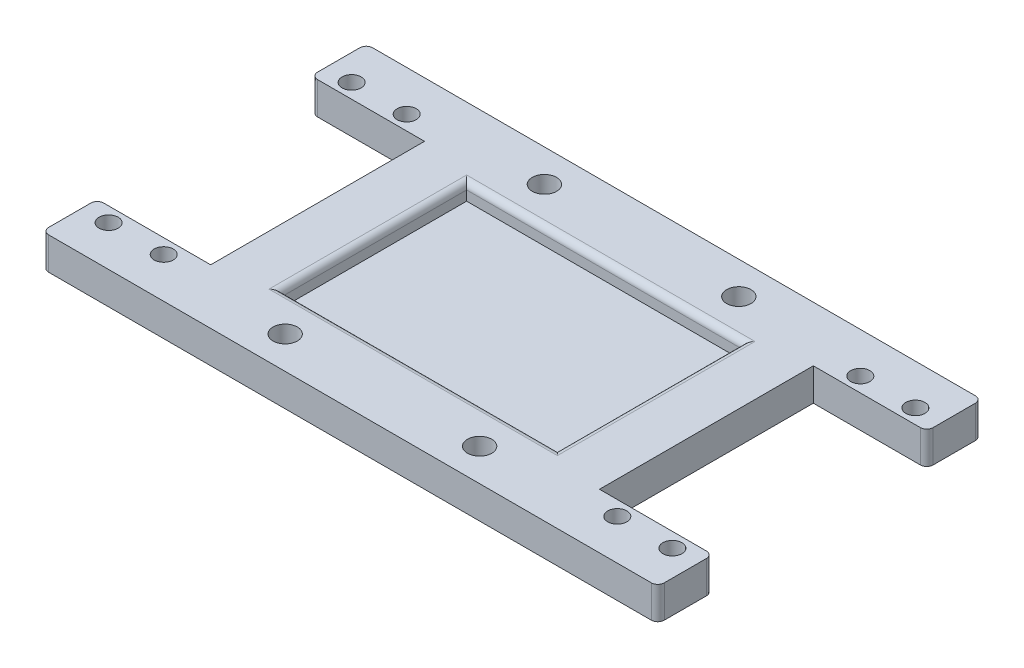
from build123d import *

# Parameters (mm, degrees)
SKETCH1_W               = 120
SKETCH1_H               = 100
BOSS_EXTRUDE1_DEPTH     = 5
SKETCH2_W               = 120
SKETCH2_H               = 100
SKETCH2_W_2             = 85
SKETCH2_H_2             = 57
BOSS_EXTRUDE2_DEPTH     = 5
SKETCH3_W               = 35
SKETCH3_H               = 17
BOSS_EXTRUDE3_DEPTH     = 10
CUT_EXTRUDE1_DEPTH      = 108.819293264
CUT_EXTRUDE1_DEPTH_BACK = 108.819293264
SKETCH4_R               = 2.95
FILLET1_R               = 2
CUT_EXTRUDE2_DEPTH      = 108.819293264
CUT_EXTRUDE2_DEPTH_BACK = 108.819293264
SKETCH5_R               = 3.75


with BuildPart() as part:
    # Sketch1 → Boss-Extrude1 (new body)
    with BuildSketch(Plane(origin=(0, 0, 0), x_dir=(1, 0, 0), z_dir=(0, 1, 0))):
        Rectangle(SKETCH1_W, SKETCH1_H)
    extrude(amount=BOSS_EXTRUDE1_DEPTH)

    # Sketch2 → Boss-Extrude2 (add)
    with BuildSketch(Plane(origin=(0, 5, 0), x_dir=(1, 0, 0), z_dir=(0, 1, 0))):
        Rectangle(SKETCH2_W, SKETCH2_H)
        Rectangle(SKETCH2_W_2, SKETCH2_H_2, mode=Mode.SUBTRACT)
    extrude(amount=BOSS_EXTRUDE2_DEPTH)

    # Sketch3 → Boss-Extrude3 (add)
    with BuildSketch(Plane.XZ):
        with Locations((77.5, 41.5)):
            Rectangle(SKETCH3_W, SKETCH3_H)
        with Locations((77.5, -41.5)):
            Rectangle(SKETCH3_W, SKETCH3_H)
        with Locations((-77.5, -41.5)):
            Rectangle(SKETCH3_W, SKETCH3_H)
        with Locations((-77.5, 41.5)):
            Rectangle(SKETCH3_W, SKETCH3_H)
    extrude(amount=-BOSS_EXTRUDE3_DEPTH)

    # Sketch4 → Cut-Extrude1 (cut, two sides: drawn at the far end of the back side and taken through both)
    with BuildSketch(Plane.XZ.offset(-CUT_EXTRUDE1_DEPTH_BACK)):
        with Locations(Location((70, 37.5, 0), (0, 0, 270))):
            Circle(SKETCH4_R)
        with Locations(Location((87, 37.5, 0), (0, 0, 270))):
            Circle(SKETCH4_R)
        with Locations(Location((70, -37.5, 0), (0, 0, 270))):
            Circle(SKETCH4_R)
        with Locations(Location((87, -37.5, 0), (0, 0, 270))):
            Circle(SKETCH4_R)
        with Locations(Location((-87, -37.5, 0), (0, 0, 270))):
            Circle(SKETCH4_R)
        with Locations(Location((-70, -37.5, 0), (0, 0, 270))):
            Circle(SKETCH4_R)
        with Locations(Location((-87, 37.5, 0), (0, 0, 270))):
            Circle(SKETCH4_R)
        with Locations(Location((-70, 37.5, 0), (0, 0, 270))):
            Circle(SKETCH4_R)
    extrude(amount=CUT_EXTRUDE1_DEPTH + CUT_EXTRUDE1_DEPTH_BACK, mode=Mode.SUBTRACT)

    # Fillet1
    fillet1_edges = [part.edges().sort_by_distance(p)[0] for p in [
        (42.5, 10, 0),
        (0, 10, -28.5),
        (-42.5, 10, 0),
        (0, 10, 28.5),
        (95, 5, 50),
        (95, 5, 33),
        (95, 5, -33),
        (95, 5, -50),
        (-95, 5, -50),
        (-95, 5, -33),
        (-95, 5, 50),
        (-95, 5, 33),
    ]]
    fillet(fillet1_edges, radius=FILLET1_R)

    # Sketch5 → Cut-Extrude2 (cut, two sides: drawn at the far end of the back side and taken through both)
    with BuildSketch(Plane(origin=(0, 10, 0), x_dir=(1, 0, 0), z_dir=(0, 1, 0)).offset(-CUT_EXTRUDE2_DEPTH_BACK)):
        with Locations(Location((-30, 40, 0), (0, 0, 270))):
            Circle(SKETCH5_R)
        with Locations(Location((30, 40, 0), (0, 0, 270))):
            Circle(SKETCH5_R)
        with Locations(Location((-30, -40, 0), (0, 0, 270))):
            Circle(SKETCH5_R)
        with Locations(Location((30, -40, 0), (0, 0, 270))):
            Circle(SKETCH5_R)
    extrude(amount=CUT_EXTRUDE2_DEPTH + CUT_EXTRUDE2_DEPTH_BACK, mode=Mode.SUBTRACT)


solid = part.part
